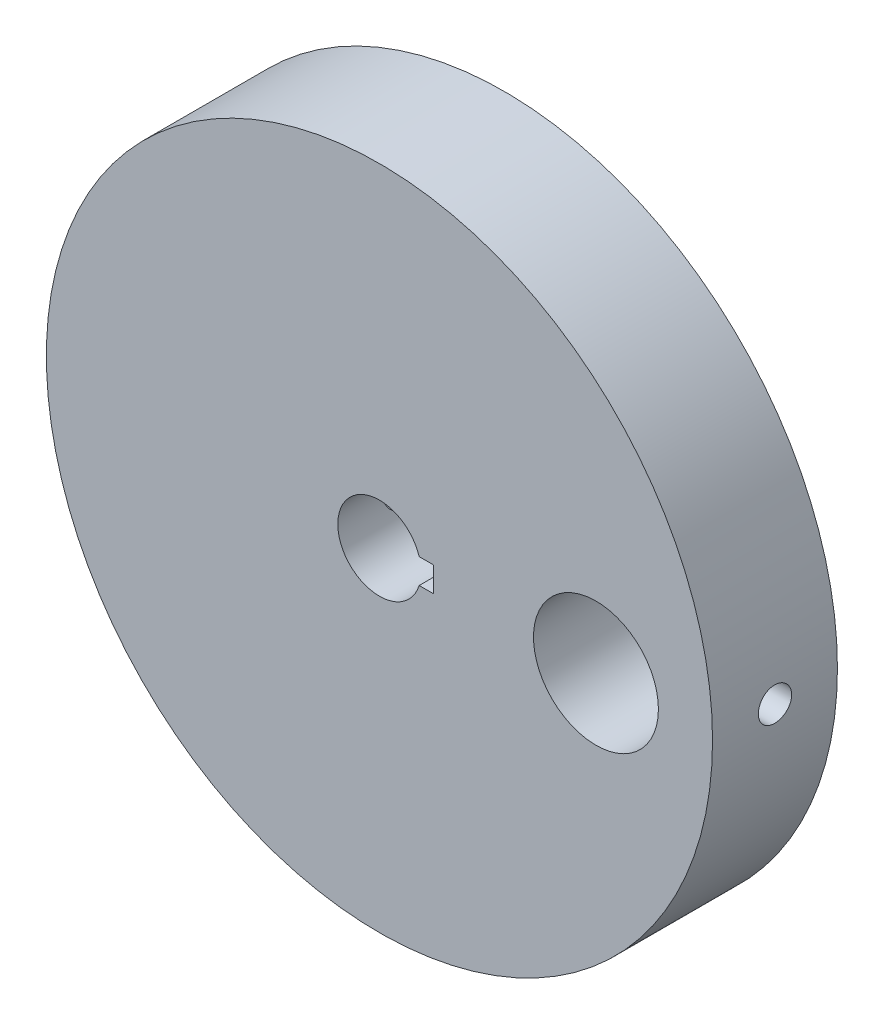
from build123d import *

# Parameters (mm, degrees)
SKETCH1_R           = 40
SKETCH1_R_2         = 7.5
BOSS_EXTRUDE1_DEPTH = 7.5
CUT_EXTRUDE1_REACH  = 59.064
SKETCH2_R           = 2
CUT_EXTRUDE2_REACH  = 99.064
CUT_EXTRUDE2_START  = 40
SKETCH2_2_R         = 2


with BuildPart() as part:
    # Sketch1 → Boss-Extrude1 (new, symmetric)
    with BuildSketch(Plane.XY):
        Circle(SKETCH1_R)
        with Locations((26, 0)):
            Circle(SKETCH1_R_2, mode=Mode.SUBTRACT)
        with BuildLine():
            Line((4.769696007, 1.5), (6.5, 1.5))
            Line((6.5, 1.5), (6.5, -1.5))
            Line((6.5, -1.5), (4.769696007, -1.5))
            ThreePointArc((4.769696007, -1.5), (-5, 0), (4.769696007, 1.5))
        make_face(mode=Mode.SUBTRACT)
    extrude(amount=BOSS_EXTRUDE1_DEPTH, both=True)

    # Sketch2 → Cut-Extrude1 (cut, up to next)
    with BuildSketch(Plane(origin=(0, 0, 0), x_dir=(0, 0, -1), z_dir=(1, 0, 0)), mode=Mode.PRIVATE) as cut_extrude1_sk1:
        Circle(SKETCH2_R)
    cut_extrude1_tool1 = extrude(cut_extrude1_sk1.sketch, amount=-CUT_EXTRUDE1_REACH, mode=Mode.PRIVATE) & part.part
    add(cut_extrude1_tool1.solids().sort_by_distance((0, 0, 0))[0], mode=Mode.SUBTRACT)

    # Sketch2<2> → Cut-Extrude2 (cut, up to next)
    with BuildSketch(Plane(origin=(0, 0, 0), x_dir=(0, 0, -1), z_dir=(1, 0, 0)).offset(CUT_EXTRUDE2_START), mode=Mode.PRIVATE) as cut_extrude2_sk1:
        Circle(SKETCH2_2_R)
    cut_extrude2_tool1 = extrude(cut_extrude2_sk1.sketch, amount=-CUT_EXTRUDE2_REACH, mode=Mode.PRIVATE) & part.part
    add(cut_extrude2_tool1.solids().sort_by_distance((40, 0, 0))[0], mode=Mode.SUBTRACT)


solid = part.part
